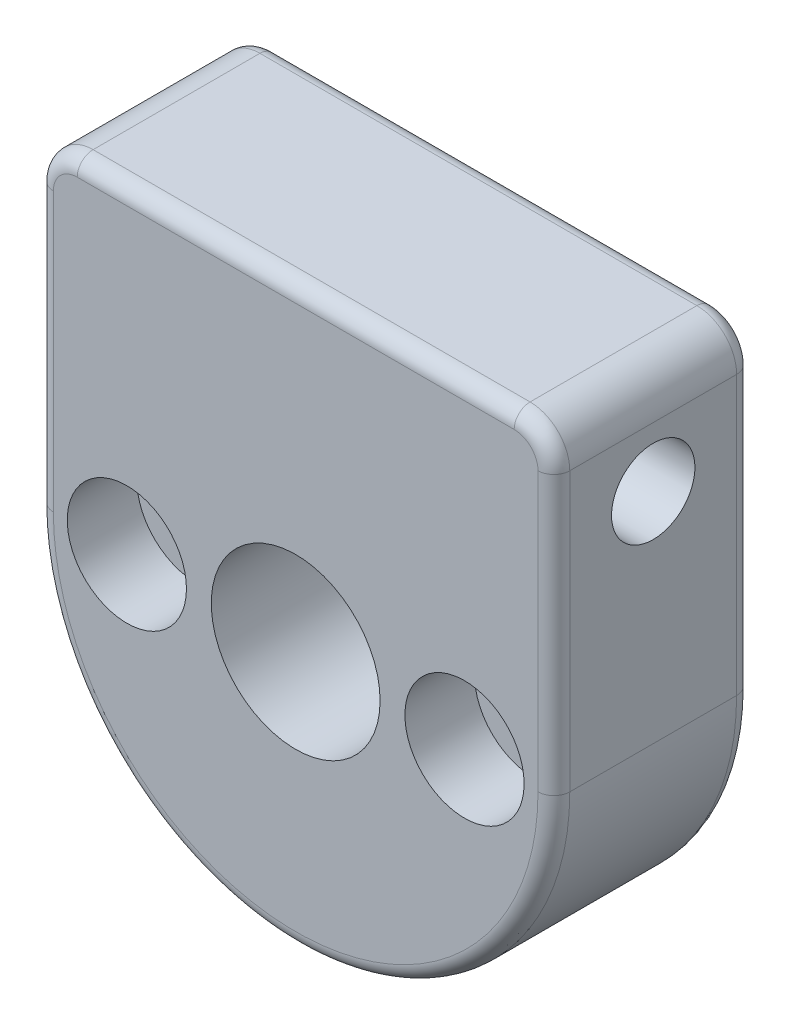
from build123d import *

# Parameters (mm, degrees)
ESQUISSE1_R             = 1.6
ESQUISSE1_R_2           = 4.25
BOSS_EXTRU_1_DEPTH      = 10
ESQUISSE2_R             = 3
ENL_V_MAT_EXTRU_1_DEPTH = 3.5
ESQUISSE3_R             = 2.1
ENL_V_MAT_EXTRU_2_DEPTH = 33.124756808
CONG_1_R                = 2
CONG_2_R                = 0.8


with BuildPart() as part:
    # Esquisse1 → Boss.-Extru.1 (new body)
    with BuildSketch(Plane.XY):
        with BuildLine():
            Line((-13, 16), (13, 16))
            Line((13, 16), (13, 0))
            ThreePointArc((13, 0), (0, -13), (-13, 0))
            Line((-13, 0), (-13, 16))
        make_face()
        with Locations((-8.5, 0)):
            Circle(ESQUISSE1_R, mode=Mode.SUBTRACT)
        with Locations(Location((8.5, 0, 0), (0, 0, 180))):
            Circle(ESQUISSE1_R, mode=Mode.SUBTRACT)
        Circle(ESQUISSE1_R_2, mode=Mode.SUBTRACT)
    extrude(amount=BOSS_EXTRU_1_DEPTH)

    # Esquisse2 → Enlèv. mat.-Extru.1 (cut)
    with BuildSketch(Plane.XY.offset(10)):
        with Locations((-8.5, 0)):
            Circle(ESQUISSE2_R)
        with Locations((8.5, 0)):
            Circle(ESQUISSE2_R)
    extrude(amount=-ENL_V_MAT_EXTRU_1_DEPTH, mode=Mode.SUBTRACT)

    # Esquisse3 → Enlèv. mat.-Extru.2 (cut, through all)
    with BuildSketch(Plane.ZY.offset(13)):
        with Locations(Location((5, 11, 0), (0, 0, 270))):
            Circle(ESQUISSE3_R)
    extrude(amount=-ENL_V_MAT_EXTRU_2_DEPTH, mode=Mode.SUBTRACT)

    # Congé1
    cong_1_edges = [part.edges().sort_by_distance(p)[0] for p in [
        (-13, 16, 5),
        (13, 16, 5),
    ]]
    fillet(cong_1_edges, radius=CONG_1_R)

    # Congé2
    cong_2_edges = [part.edges().sort_by_distance(p)[0] for p in [
        (13, 7, 10),
        (0, 16, 0),
        (0, 16, 10),
        (-13, 7, 0),
        (-12.414213562, 15.414213562, 0),
        (12.414213562, 15.414213562, 0),
        (-13, 7, 10),
        (-12.414213562, 15.414213562, 10),
        (12.414213562, 15.414213562, 10),
        (13, 7, 0),
        (0, -13, 0),
        (0, -13, 10),
    ]]
    fillet(cong_2_edges, radius=CONG_2_R)


solid = part.part
